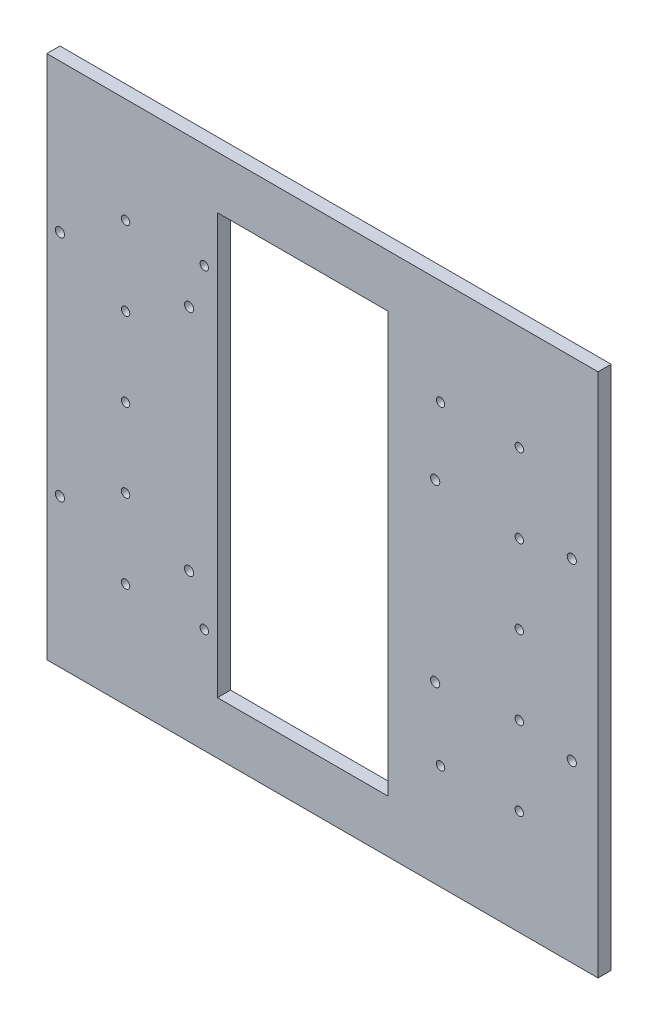
from build123d import *

# Parameters (mm, degrees)
SKETCH_1_W          = 170
SKETCH_1_H          = 200
SKETCH_1_R          = 1.6
SKETCH_1_W_2        = 65
SKETCH_1_H_2        = 160
EXTRUDE_1_DEPTH     = 5
SKETCH_5_W          = 5
SKETCH_5_H          = 200
EXTRUDE_2_DEPTH     = 20
SKETCH_4_R          = 1.75
CUT_EXTRUDE_1_DEPTH = 30
SKETCH_6_W          = 5
SKETCH_6_H          = 200
EXTRUDE_3_DEPTH     = 20
CUT_EXTRUDE_2_DEPTH = 20


with BuildPart() as part:
    # 草图1 → 凸台-拉伸1 (new body)
    with BuildSketch(Plane.XY):
        with Locations((0.050009972, 0.429149843)):
            Rectangle(SKETCH_1_W, SKETCH_1_H)
        with Locations((-74.949990028, 60.429149843)):
            Circle(SKETCH_1_R, mode=Mode.SUBTRACT)
        with Locations((-74.949990028, -59.570850157)):
            Circle(SKETCH_1_R, mode=Mode.SUBTRACT)
        with Locations((75.050009972, -59.570850157)):
            Circle(SKETCH_1_R, mode=Mode.SUBTRACT)
        with Locations((75.050009972, 60.429149843)):
            Circle(SKETCH_1_R, mode=Mode.SUBTRACT)
        with Locations((75.050009972, 30.429149843)):
            Circle(SKETCH_1_R, mode=Mode.SUBTRACT)
        with Locations((-74.949990028, 30.429149843)):
            Circle(SKETCH_1_R, mode=Mode.SUBTRACT)
        with Locations((45.050009972, -59.570850157)):
            Circle(SKETCH_1_R, mode=Mode.SUBTRACT)
        with Locations((-74.949990028, 0.429149843)):
            Circle(SKETCH_1_R, mode=Mode.SUBTRACT)
        with Locations((75.050009972, 0.429149843)):
            Circle(SKETCH_1_R, mode=Mode.SUBTRACT)
        with Locations((-74.949990028, -29.570850157)):
            Circle(SKETCH_1_R, mode=Mode.SUBTRACT)
        with Locations((75.050009972, -29.570850157)):
            Circle(SKETCH_1_R, mode=Mode.SUBTRACT)
        with Locations((-44.949990028, -59.570850157)):
            Circle(SKETCH_1_R, mode=Mode.SUBTRACT)
        with Locations((45.050009972, 60.429149843)):
            Circle(SKETCH_1_R, mode=Mode.SUBTRACT)
        with Locations((-44.949990028, 60.429149843)):
            Circle(SKETCH_1_R, mode=Mode.SUBTRACT)
        with Locations((-7.449990028, 0.429149843)):
            Rectangle(SKETCH_1_W_2, SKETCH_1_H_2, mode=Mode.SUBTRACT)
    extrude(amount=EXTRUDE_1_DEPTH)

    # 草图5 → 凸台-拉伸2 (add)
    with BuildSketch(Plane.ZY.offset(84.949990028)):
        with Locations((2.5, 0.429149843)):
            Rectangle(SKETCH_5_W, SKETCH_5_H)
    extrude(amount=EXTRUDE_2_DEPTH)

    # 草图4 → 切除-拉伸1 (cut)
    with BuildSketch(Plane.XY.offset(5)):
        with BuildLine():
            Line((-99.949990028, 42.219149843), (-99.949990028, 43.969149843))
            Line((-99.949990028, 43.969149843), (-98.199990028, 43.969149843))
            ThreePointArc((-98.199990028, 43.969149843), (-101.187426895, 45.206586711), (-99.949990028, 42.219149843))
        make_face()
        with BuildLine():
            Line((-98.199990028, 43.969149843), (-99.949990028, 43.969149843))
            Line((-99.949990028, 43.969149843), (-99.949990028, 42.219149843))
            ThreePointArc((-99.949990028, 42.219149843), (-98.712553161, 42.731712976), (-98.199990028, 43.969149843))
        make_face()
        with BuildLine():
            Line((-99.949990028, 42.219149843), (-99.949990028, 43.969149843))
            Line((-99.949990028, 43.969149843), (-98.199990028, 43.969149843))
            ThreePointArc((-98.199990028, 43.969149843), (-101.187426895, 45.206586711), (-99.949990028, 42.219149843))
        make_face()
        with BuildLine():
            Line((-98.199990028, 43.969149843), (-99.949990028, 43.969149843))
            Line((-99.949990028, 43.969149843), (-99.949990028, 42.219149843))
            ThreePointArc((-99.949990028, 42.219149843), (-98.712553161, 42.731712976), (-98.199990028, 43.969149843))
        make_face()
        with BuildLine():
            ThreePointArc((-98.199990028, -43.110850157), (-98.712553161, -41.873413289), (-99.949990028, -41.360850157))
            Line((-99.949990028, -41.360850157), (-99.949990028, -43.110850157))
            Line((-99.949990028, -43.110850157), (-98.199990028, -43.110850157))
        make_face()
        with BuildLine():
            Line((-99.949990028, -43.110850157), (-99.949990028, -41.360850157))
            ThreePointArc((-99.949990028, -41.360850157), (-101.187426895, -44.348287024), (-98.199990028, -43.110850157))
            Line((-98.199990028, -43.110850157), (-99.949990028, -43.110850157))
        make_face()
        with BuildLine():
            ThreePointArc((-98.199990028, -43.110850157), (-98.712553161, -41.873413289), (-99.949990028, -41.360850157))
            Line((-99.949990028, -41.360850157), (-99.949990028, -43.110850157))
            Line((-99.949990028, -43.110850157), (-98.199990028, -43.110850157))
        make_face()
        with BuildLine():
            Line((-99.949990028, -43.110850157), (-99.949990028, -41.360850157))
            ThreePointArc((-99.949990028, -41.360850157), (-101.187426895, -44.348287024), (-98.199990028, -43.110850157))
            Line((-98.199990028, -43.110850157), (-99.949990028, -43.110850157))
        make_face()
        with BuildLine():
            ThreePointArc((-48.989990028, -43.110850157), (-49.502553161, -41.873413289), (-50.739990028, -41.360850157))
            Line((-50.739990028, -41.360850157), (-50.739990028, -43.110850157))
            Line((-50.739990028, -43.110850157), (-52.489990028, -43.110850157))
            ThreePointArc((-52.489990028, -43.110850157), (-50.739990028, -44.860850157), (-48.989990028, -43.110850157))
        make_face()
        with BuildLine():
            Line((-50.739990028, -43.110850157), (-50.739990028, -41.360850157))
            ThreePointArc((-50.739990028, -41.360850157), (-51.977426895, -41.873413289), (-52.489990028, -43.110850157))
            Line((-52.489990028, -43.110850157), (-50.739990028, -43.110850157))
        make_face()
        with BuildLine():
            ThreePointArc((-48.989990028, -43.110850157), (-49.502553161, -41.873413289), (-50.739990028, -41.360850157))
            Line((-50.739990028, -41.360850157), (-50.739990028, -43.110850157))
            Line((-50.739990028, -43.110850157), (-52.489990028, -43.110850157))
            ThreePointArc((-52.489990028, -43.110850157), (-50.739990028, -44.860850157), (-48.989990028, -43.110850157))
        make_face()
        with BuildLine():
            Line((-50.739990028, -43.110850157), (-50.739990028, -41.360850157))
            ThreePointArc((-50.739990028, -41.360850157), (-51.977426895, -41.873413289), (-52.489990028, -43.110850157))
            Line((-52.489990028, -43.110850157), (-50.739990028, -43.110850157))
        make_face()
        with Locations((-50.739990028, 43.969149843)):
            Circle(SKETCH_4_R)
    extrude(amount=-CUT_EXTRUDE_1_DEPTH, mode=Mode.SUBTRACT)

    # 草图6 → 凸台-拉伸3 (add)
    with BuildSketch(Plane(origin=(85.050009972, 0, 0), x_dir=(0, 0, -1), z_dir=(1, 0, 0))):
        with Locations((-2.5, 0.429149843)):
            Rectangle(SKETCH_6_W, SKETCH_6_H)
    extrude(amount=EXTRUDE_3_DEPTH)

    # 草图7 → 切除-拉伸2 (cut)
    with BuildSketch(Plane.XY.offset(5)):
        with BuildLine():
            Line((43.000009972, 32.029149843), (43.000009972, 33.779149843))
            Line((43.000009972, 33.779149843), (44.750009972, 33.779149843))
            ThreePointArc((44.750009972, 33.779149843), (41.762573105, 35.016586711), (43.000009972, 32.029149843))
        make_face()
        with BuildLine():
            Line((44.750009972, 33.779149843), (43.000009972, 33.779149843))
            Line((43.000009972, 33.779149843), (43.000009972, 32.029149843))
            ThreePointArc((43.000009972, 32.029149843), (44.237446839, 32.541712976), (44.750009972, 33.779149843))
        make_face()
        with BuildLine():
            Line((43.000009972, 32.029149843), (43.000009972, 33.779149843))
            Line((43.000009972, 33.779149843), (44.750009972, 33.779149843))
            ThreePointArc((44.750009972, 33.779149843), (41.762573105, 35.016586711), (43.000009972, 32.029149843))
        make_face()
        with BuildLine():
            Line((44.750009972, 33.779149843), (43.000009972, 33.779149843))
            Line((43.000009972, 33.779149843), (43.000009972, 32.029149843))
            ThreePointArc((43.000009972, 32.029149843), (44.237446839, 32.541712976), (44.750009972, 33.779149843))
        make_face()
        with BuildLine():
            ThreePointArc((44.750009972, -32.920850157), (44.237446839, -31.683413289), (43.000009972, -31.170850157))
            Line((43.000009972, -31.170850157), (43.000009972, -32.920850157))
            Line((43.000009972, -32.920850157), (44.750009972, -32.920850157))
        make_face()
        with BuildLine():
            Line((43.000009972, -32.920850157), (43.000009972, -31.170850157))
            ThreePointArc((43.000009972, -31.170850157), (41.762573105, -34.158287024), (44.750009972, -32.920850157))
            Line((44.750009972, -32.920850157), (43.000009972, -32.920850157))
        make_face()
        with BuildLine():
            ThreePointArc((44.750009972, -32.920850157), (44.237446839, -31.683413289), (43.000009972, -31.170850157))
            Line((43.000009972, -31.170850157), (43.000009972, -32.920850157))
            Line((43.000009972, -32.920850157), (44.750009972, -32.920850157))
        make_face()
        with BuildLine():
            Line((43.000009972, -32.920850157), (43.000009972, -31.170850157))
            ThreePointArc((43.000009972, -31.170850157), (41.762573105, -34.158287024), (44.750009972, -32.920850157))
            Line((44.750009972, -32.920850157), (43.000009972, -32.920850157))
        make_face()
        with BuildLine():
            ThreePointArc((96.800009972, -32.920850157), (96.287446839, -31.683413289), (95.050009972, -31.170850157))
            Line((95.050009972, -31.170850157), (95.050009972, -32.920850157))
            Line((95.050009972, -32.920850157), (93.300009972, -32.920850157))
            ThreePointArc((93.300009972, -32.920850157), (95.050009972, -34.670850157), (96.800009972, -32.920850157))
        make_face()
        with BuildLine():
            Line((95.050009972, -32.920850157), (95.050009972, -31.170850157))
            ThreePointArc((95.050009972, -31.170850157), (93.812573105, -31.683413289), (93.300009972, -32.920850157))
            Line((93.300009972, -32.920850157), (95.050009972, -32.920850157))
        make_face()
        with BuildLine():
            ThreePointArc((96.800009972, -32.920850157), (96.287446839, -31.683413289), (95.050009972, -31.170850157))
            Line((95.050009972, -31.170850157), (95.050009972, -32.920850157))
            Line((95.050009972, -32.920850157), (93.300009972, -32.920850157))
            ThreePointArc((93.300009972, -32.920850157), (95.050009972, -34.670850157), (96.800009972, -32.920850157))
        make_face()
        with BuildLine():
            Line((95.050009972, -32.920850157), (95.050009972, -31.170850157))
            ThreePointArc((95.050009972, -31.170850157), (93.812573105, -31.683413289), (93.300009972, -32.920850157))
            Line((93.300009972, -32.920850157), (95.050009972, -32.920850157))
        make_face()
        with BuildLine():
            ThreePointArc((96.800009972, 33.779149843), (95.050009972, 35.529149843), (93.300009972, 33.779149843))
            Line((93.300009972, 33.779149843), (95.050009972, 33.779149843))
            Line((95.050009972, 33.779149843), (95.050009972, 32.029149843))
            ThreePointArc((95.050009972, 32.029149843), (96.287446839, 32.541712976), (96.800009972, 33.779149843))
        make_face()
        with BuildLine():
            Line((95.050009972, 33.779149843), (93.300009972, 33.779149843))
            ThreePointArc((93.300009972, 33.779149843), (93.812573105, 32.541712976), (95.050009972, 32.029149843))
            Line((95.050009972, 32.029149843), (95.050009972, 33.779149843))
        make_face()
        with BuildLine():
            ThreePointArc((96.800009972, 33.779149843), (95.050009972, 35.529149843), (93.300009972, 33.779149843))
            Line((93.300009972, 33.779149843), (95.050009972, 33.779149843))
            Line((95.050009972, 33.779149843), (95.050009972, 32.029149843))
            ThreePointArc((95.050009972, 32.029149843), (96.287446839, 32.541712976), (96.800009972, 33.779149843))
        make_face()
        with BuildLine():
            Line((95.050009972, 33.779149843), (93.300009972, 33.779149843))
            ThreePointArc((93.300009972, 33.779149843), (93.812573105, 32.541712976), (95.050009972, 32.029149843))
            Line((95.050009972, 32.029149843), (95.050009972, 33.779149843))
        make_face()
    extrude(amount=-CUT_EXTRUDE_2_DEPTH, mode=Mode.SUBTRACT)


solid = part.part
